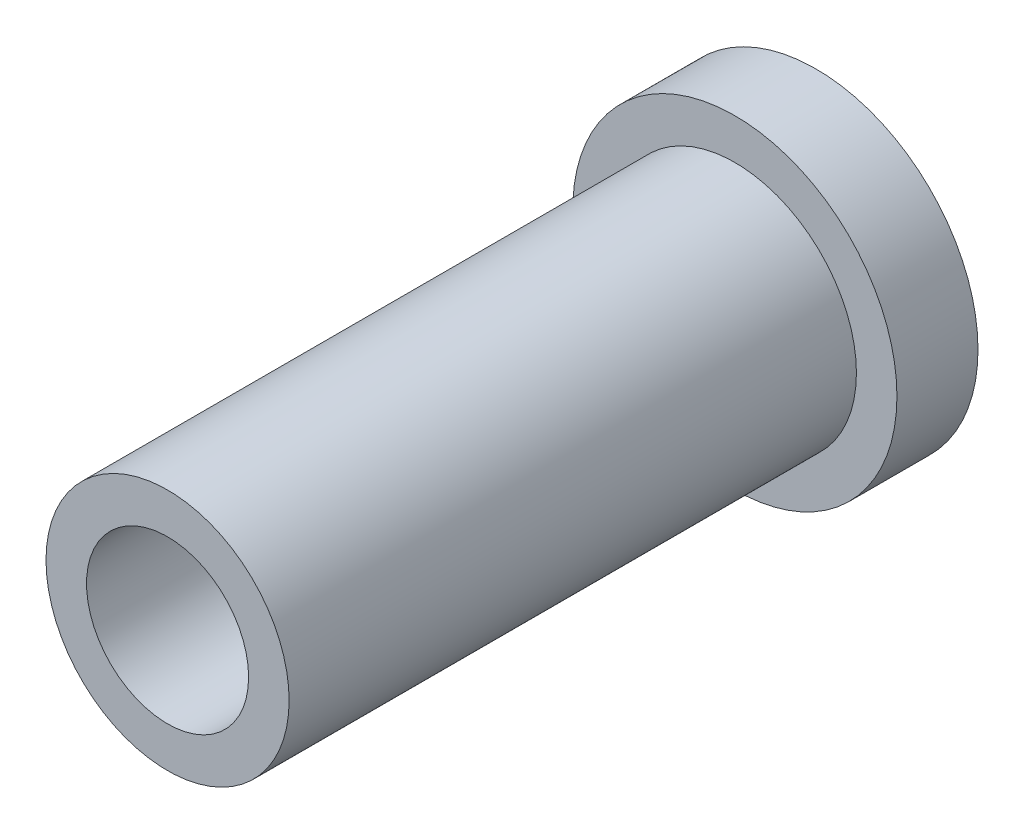
from build123d import *

# Parameters (mm, degrees)
ESQUISSE1_R        = 4
ESQUISSE1_R_2      = 2
BOSS_EXTRU_1_DEPTH = 2
ESQUISSE2_R        = 3
ESQUISSE2_R_2      = 2
BOSS_EXTRU_2_DEPTH = 14


with BuildPart() as part:
    # Esquisse1 → Boss.-Extru.1 (new body)
    with BuildSketch(Plane.XY):
        with Locations((1.373903483, 0.601987724)):
            Circle(ESQUISSE1_R)
        with Locations((1.373903483, 0.601987724)):
            Circle(ESQUISSE1_R_2, mode=Mode.SUBTRACT)
    extrude(amount=BOSS_EXTRU_1_DEPTH)

    # Esquisse2 → Boss.-Extru.2 (add)
    with BuildSketch(Plane.XY.offset(2)):
        with Locations((1.373903483, 0.601987724)):
            Circle(ESQUISSE2_R)
        with Locations((1.373903483, 0.601987724)):
            Circle(ESQUISSE2_R_2, mode=Mode.SUBTRACT)
    extrude(amount=BOSS_EXTRU_2_DEPTH)


solid = part.part
